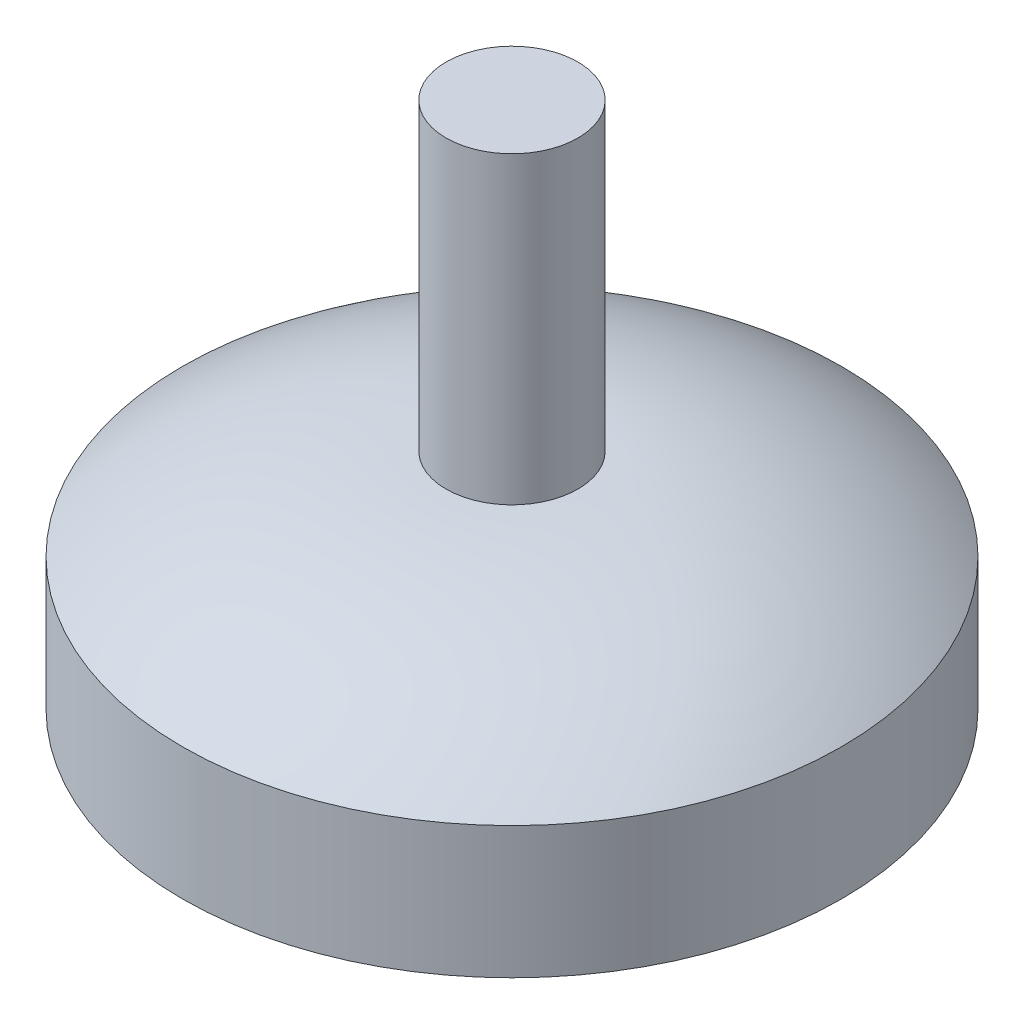
from build123d import *

# Parameters (mm, degrees)
CROQUIS1_R              = 25
SALIENTE_EXTRUIR1_DEPTH = 10
CROQUIS2_R              = 5
SALIENTE_EXTRUIR2_DEPTH = 30


with BuildPart() as part:
    # Croquis1 → Saliente-Extruir1 (new body)
    with BuildSketch(Plane(origin=(0, 0, 0), x_dir=(1, 0, 0), z_dir=(0, 1, 0))):
        with Locations(Location((0, 0, 0), (0, 0, 270))):
            Circle(CROQUIS1_R)
    extrude(amount=SALIENTE_EXTRUIR1_DEPTH)

    # Croquis2 → Saliente-Extruir2 (add)
    with BuildSketch(Plane(origin=(0, 10, 0), x_dir=(1, 0, 0), z_dir=(0, 1, 0))):
        with Locations(Location((0, 0, 0), (0, 0, 270))):
            Circle(CROQUIS2_R)
    extrude(amount=SALIENTE_EXTRUIR2_DEPTH)

    # Croquis4 → Revolución1 (revolve)
    with BuildSketch(Plane.XY, mode=Mode.PRIVATE) as revoluci_n1_sk:
        with BuildLine():
            Line((5, 16.931653532), (5, 10))
            Line((5, 10), (25, 10))
            add(Edge.make_bspline(
                [(25, 10), (16.233689239, 16.931653532), (5, 16.931653532)],
                knots=[0, 0, 0, 1, 1, 1], degree=2))
        make_face()
    revolve(revoluci_n1_sk.sketch.rotate(Axis((0, 40, 0), (0, -1, 0)), 90), axis=Axis((0, 40, 0), (0, -1, 0)))


solid = part.part
